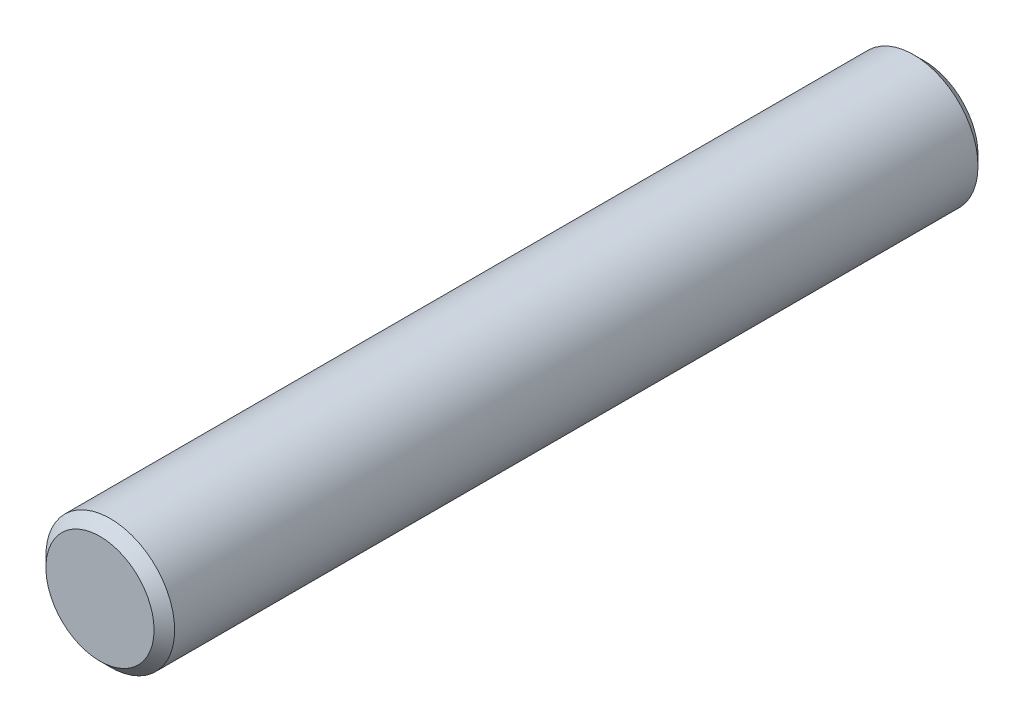
from build123d import *

# Parameters (mm, degrees)
SKETCH1_R           = 6.35
BOSS_EXTRUDE1_DEPTH = 81.28
CHAMFER1_SIZE       = 1.016


with BuildPart() as part:
    # Sketch1 → Boss-Extrude1 (new body)
    with BuildSketch(Plane.XY):
        Circle(SKETCH1_R)
    extrude(amount=BOSS_EXTRUDE1_DEPTH)

    # Chamfer1
    chamfer1_edges = [part.edges().sort_by_distance(p)[0] for p in [
        (-6.35, 0, 0),
        (-6.35, 0, 81.28),
    ]]
    chamfer(chamfer1_edges, length=CHAMFER1_SIZE)


solid = part.part
